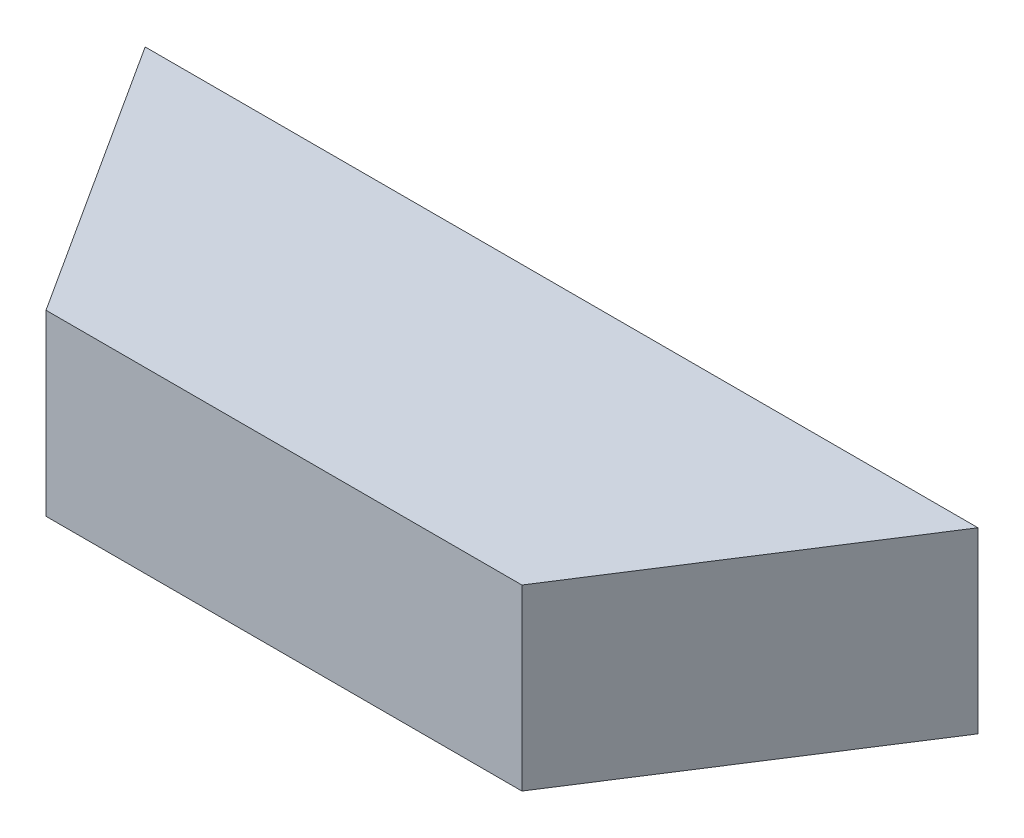
from build123d import *

# Parameters (mm, degrees)
BOSS_EXTRUDE1_DEPTH = 57.15
SHELL1_T            = -1.5875


with BuildPart() as part:
    # Sketch1 → Boss-Extrude1 (new body)
    with BuildSketch(Plane(origin=(0, 0, 0), x_dir=(1, 0, 0), z_dir=(0, 1, 0))):
        Polygon((0, 0), (-152.4, 0), (-209.55, 88.9), (57.15, 88.9), align=None)
    extrude(amount=BOSS_EXTRUDE1_DEPTH)

    # Shell1
    shell1_openings = [part.faces().sort_by_distance(p)[0] for p in [
        (-76.2, 28.575, -88.9),
    ]]
    offset(amount=SHELL1_T, openings=shell1_openings, kind=Kind.INTERSECTION)


solid = part.part
